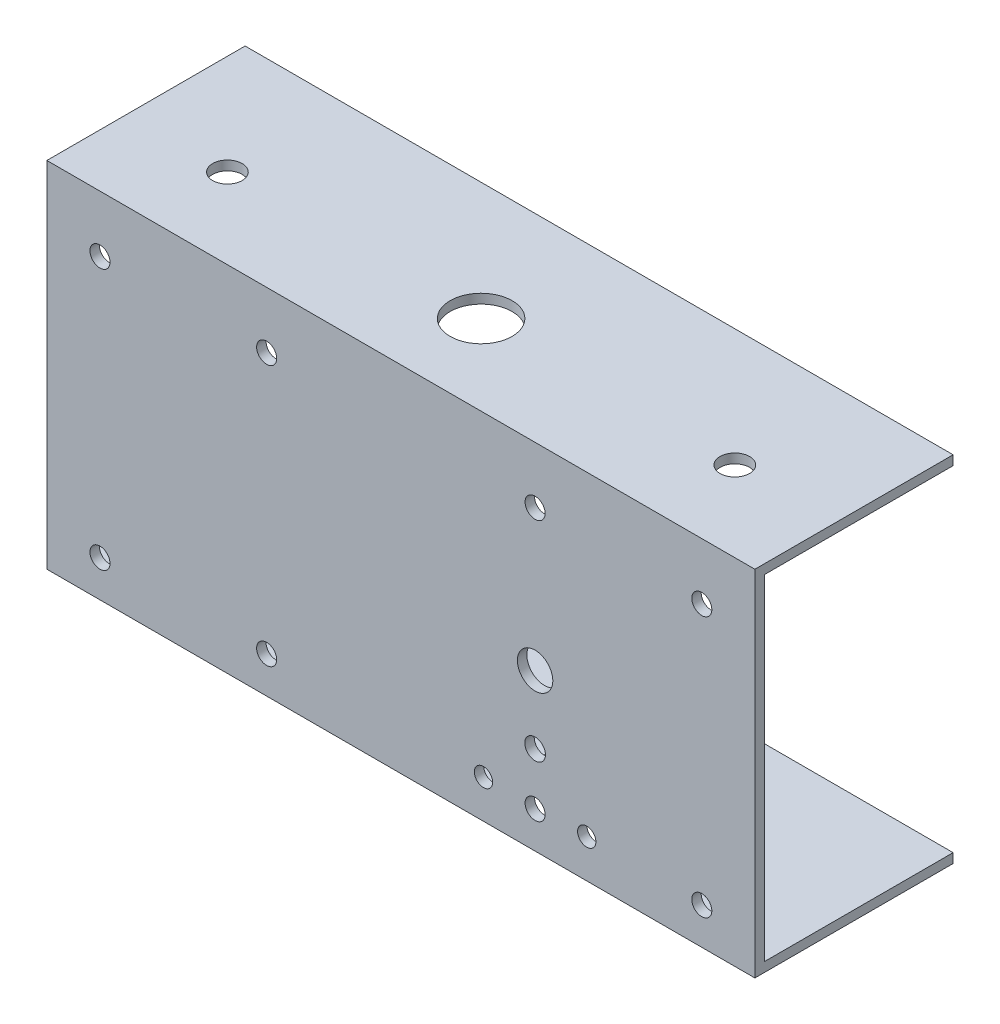
from build123d import *

# Parameters (mm, degrees)
SKETCH1_R           = 5.25
SKETCH1_R_2         = 2.5
BOSS_EXTRUDE1_DEPTH = 1.6
SKETCH3_W           = 120
SKETCH3_H           = 1.6
BOSS_EXTRUDE3_DEPTH = 60
SKETCH4_R           = 3
SKETCH4_R_2         = 1.55
SKETCH4_R_3         = 1.75
CUT_EXTRUDE1_DEPTH  = 10
SKETCH6_R           = 1.7
CUT_EXTRUDE2_DEPTH  = 25
SKETCH7_W           = 25.5
SKETCH7_H           = 1.6
BOSS_EXTRUDE4_DEPTH = 25


with BuildPart() as part:
    # Sketch1 → Boss-Extrude1 (new body)
    with BuildSketch(Plane(origin=(0, 0, 0), x_dir=(1, 0, 0), z_dir=(0, 1, 0))):
        Polygon((34.5, -12), (34.5, 13.5), (11, 13.5), (11, -12), (-60, -12), (-60, 20), (60, 20), (60, -12), align=None)
        with Locations(Location((0, 0, 0), (0, 0, 270))):
            Circle(SKETCH1_R, mode=Mode.SUBTRACT)
        with Locations(Location((-43, 0, 0), (0, 0, 270))):
            Circle(SKETCH1_R_2, mode=Mode.SUBTRACT)
        with Locations(Location((43, 0, 0), (0, 0, 90))):
            Circle(SKETCH1_R_2, mode=Mode.SUBTRACT)
    boss_extrude1 = extrude(amount=BOSS_EXTRUDE1_DEPTH)

    # Sketch3 → Boss-Extrude3 (add)
    with BuildSketch(Plane.XZ):
        with Locations((0, 12.8)):
            Rectangle(SKETCH3_W, SKETCH3_H)
    extrude(amount=-BOSS_EXTRUDE3_DEPTH)

    # Mirror1: Boss-Extrude1 across plane
    add(boss_extrude1.mirror(Plane.ZX.offset(30)))

    # Sketch4 → Cut-Extrude1 (cut)
    with BuildSketch(Plane.XY.offset(12)):
        with Locations(Location((22.75, 26.5, 0), (0, 0, 180))):
            Circle(SKETCH4_R)
        with Locations(Location((31.5, 6.5, 0), (0, 0, 180))):
            Circle(SKETCH4_R_2)
        with Locations(Location((14, 6.5, 0), (0, 0, 180))):
            Circle(SKETCH4_R_2)
        with Locations(Location((22.75, 15, 0), (0, 0, 180))):
            Circle(SKETCH4_R_3)
    extrude(amount=CUT_EXTRUDE1_DEPTH, mode=Mode.SUBTRACT)

    # Sketch6 → Cut-Extrude2 (cut)
    with BuildSketch(Plane(origin=(124.244525073, 40.7, 12), x_dir=(1, 0, 0), z_dir=(0, 0, 1))):
        with Locations(Location((-175.244525073, 9.7, 0), (0, 0, 180))):
            Circle(SKETCH6_R)
        with Locations(Location((-146.994525073, 9.7, 0), (0, 0, 180))):
            Circle(SKETCH6_R)
        with Locations(Location((-101.494525073, 9.7, 0), (0, 0, 180))):
            Circle(SKETCH6_R)
        with Locations(Location((-73.244525073, 9.7, 0), (0, 0, 180))):
            Circle(SKETCH6_R)
        with Locations((-175.244525073, -34.5)):
            Circle(SKETCH6_R)
        with Locations((-146.994525073, -34.5)):
            Circle(SKETCH6_R)
        with Locations(Location((-101.494525073, -34.5, 0), (0, 0, 180))):
            Circle(SKETCH6_R)
        with Locations(Location((-73.244525073, -34.5, 0), (0, 0, 180))):
            Circle(SKETCH6_R)
    extrude(amount=CUT_EXTRUDE2_DEPTH, mode=Mode.SUBTRACT)

    # Sketch7 → Boss-Extrude4 (add)
    with BuildSketch(Plane.ZY.offset(-34.5)):
        with Locations((-0.75, 59.2)):
            Rectangle(SKETCH7_W, SKETCH7_H)
    extrude(amount=BOSS_EXTRUDE4_DEPTH)


solid = part.part
